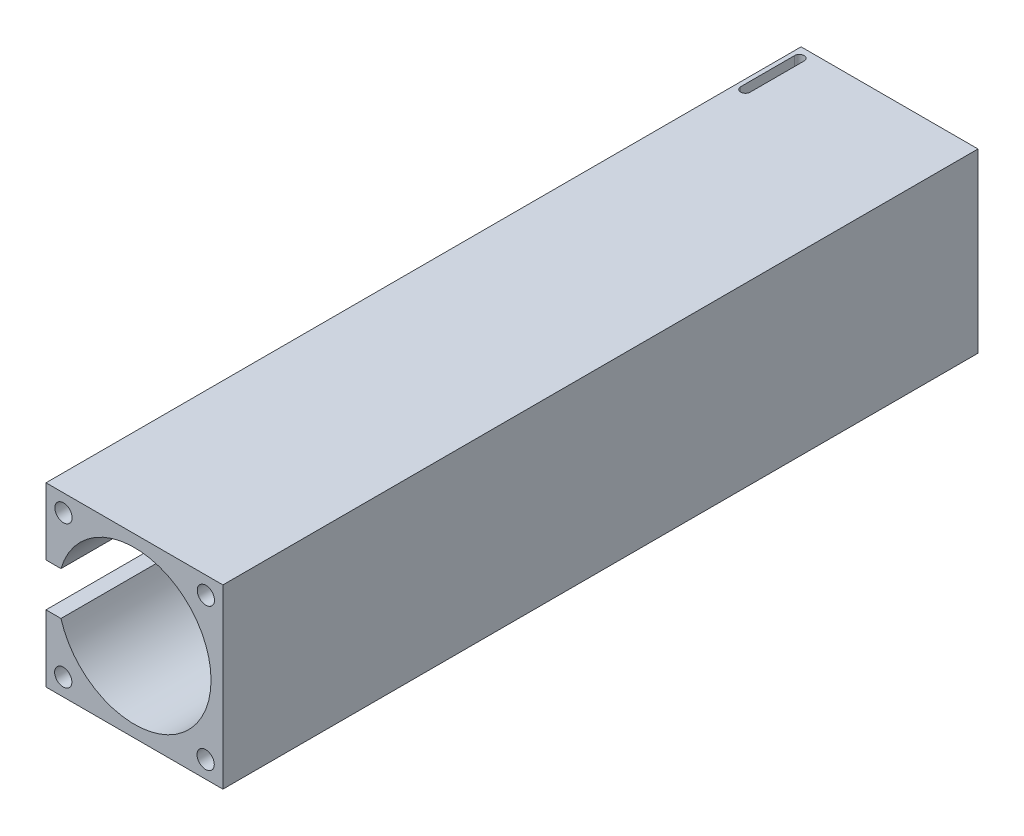
from build123d import *

# Parameters (mm, degrees)
SKETCH_1_W          = 82
SKETCH_1_H          = 82
SKETCH_1_R          = 35.5
EXTRUDE_1_DEPTH     = 315
SKETCH_2_W          = 82
SKETCH_2_H          = 82
EXTRUDE_2_DEPTH     = 35
SKETCH_3_W          = 8
SKETCH_3_H          = 20
CUT_EXTRUDE_1_DEPTH = 315
SKETCH_4_R          = 4
CUT_EXTRUDE_2_DEPTH = 20
FILLET_2_R          = 3
FILLET_3_R          = 3
FILLET_4_R          = 3
FILLET_5_R          = 3
CUT_EXTRUDE_3_DEPTH = 12
SKETCH_6_W          = 29.4
SKETCH_6_H          = 3
CUT_EXTRUDE_4_DEPTH = 10


with BuildPart() as part:
    # 草圖1 → 填料-伸長1 (new body)
    with BuildSketch(Plane.XY):
        Rectangle(SKETCH_1_W, SKETCH_1_H)
        Circle(SKETCH_1_R, mode=Mode.SUBTRACT)
    extrude(amount=EXTRUDE_1_DEPTH)

    # 草圖2 → 填料-伸長2 (add)
    with BuildSketch(Plane(origin=(0, 0, 0), x_dir=(-1, 0, 0), z_dir=(0, 0, -1))):
        Rectangle(SKETCH_2_W, SKETCH_2_H)
    extrude(amount=EXTRUDE_2_DEPTH)

    # 草圖3 → 除料-伸長1 (cut)
    with BuildSketch(Plane.XY.offset(315)):
        with Locations((-37, 0)):
            Rectangle(SKETCH_3_W, SKETCH_3_H)
    extrude(amount=-CUT_EXTRUDE_1_DEPTH, mode=Mode.SUBTRACT)

    # 草圖4 → 除料-伸長2 (cut)
    with BuildSketch(Plane.XY.offset(315)):
        with Locations((-32.9, 33)):
            Circle(SKETCH_4_R)
        with Locations((33.1, 32.9)):
            Circle(SKETCH_4_R)
        with Locations((33, -33.1)):
            Circle(SKETCH_4_R)
        with Locations((-33, -33)):
            Circle(SKETCH_4_R)
    extrude(amount=-CUT_EXTRUDE_2_DEPTH, mode=Mode.SUBTRACT)

    # 圓角2
    fillet_2_edges = [part.edges().sort_by_distance(p)[0] for p in [
        (-36.9, 33, 295),
    ]]
    fillet(fillet_2_edges, radius=FILLET_2_R)

    # 圓角3
    fillet_3_edges = [part.edges().sort_by_distance(p)[0] for p in [
        (29.1, 32.9, 295),
    ]]
    fillet(fillet_3_edges, radius=FILLET_3_R)

    # 圓角4
    fillet_4_edges = [part.edges().sort_by_distance(p)[0] for p in [
        (-37, -33, 295),
    ]]
    fillet(fillet_4_edges, radius=FILLET_4_R)

    # 圓角5
    fillet_5_edges = [part.edges().sort_by_distance(p)[0] for p in [
        (29, -33.1, 295),
    ]]
    fillet(fillet_5_edges, radius=FILLET_5_R)

    # 草圖5 → 除料-伸長3 (cut)
    with BuildSketch(Plane(origin=(0, 41, 0), x_dir=(1, 0, 0), z_dir=(0, 1, 0))):
        with BuildLine():
            Line((-39, 5), (-39, 30))
            ThreePointArc((-39, 30), (-36.8, 32.2), (-34.6, 30))
            Line((-34.6, 30), (-34.6, 5))
            ThreePointArc((-34.6, 5), (-36.8, 2.8), (-39, 5))
        make_face()
    extrude(amount=-CUT_EXTRUDE_3_DEPTH, mode=Mode.SUBTRACT)

    # 草圖6 → 除料-伸長4 (cut)
    with BuildSketch(Plane.ZY.offset(41)):
        with Locations((-17.5, 34.5)):
            Rectangle(SKETCH_6_W, SKETCH_6_H)
    extrude(amount=-CUT_EXTRUDE_4_DEPTH, mode=Mode.SUBTRACT)


solid = part.part
